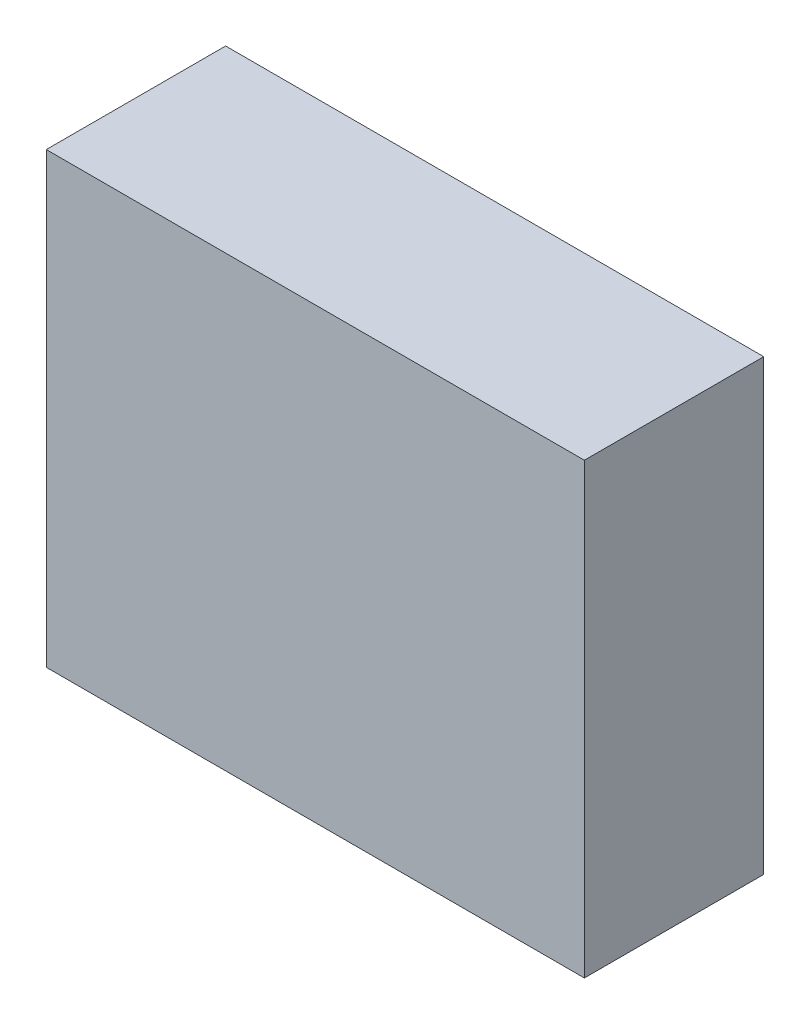
from build123d import *

# Parameters (mm, degrees)
SKETCH1_W           = 60
SKETCH1_H           = 50
BOSS_EXTRUDE1_DEPTH = 10
SKETCH2_W           = 15
SKETCH2_H           = 30
CUT_REVOLVE1_ANGLE  = 120


with BuildPart() as part:
    # Sketch1 → Boss-Extrude1 (new, symmetric)
    with BuildSketch(Plane.XY):
        with Locations((0, 15)):
            Rectangle(SKETCH1_W, SKETCH1_H)
    extrude(amount=BOSS_EXTRUDE1_DEPTH, both=True)

    # Sketch2 → Cut-Revolve1 (revolve, cut)
    with BuildSketch(Plane.XY):
        with Locations((12.5, 15)):
            Rectangle(SKETCH2_W, SKETCH2_H)
    revolve(axis=Axis((0, 0, 0), (0, 1, 0)), revolution_arc=CUT_REVOLVE1_ANGLE, mode=Mode.SUBTRACT)


solid = part.part
